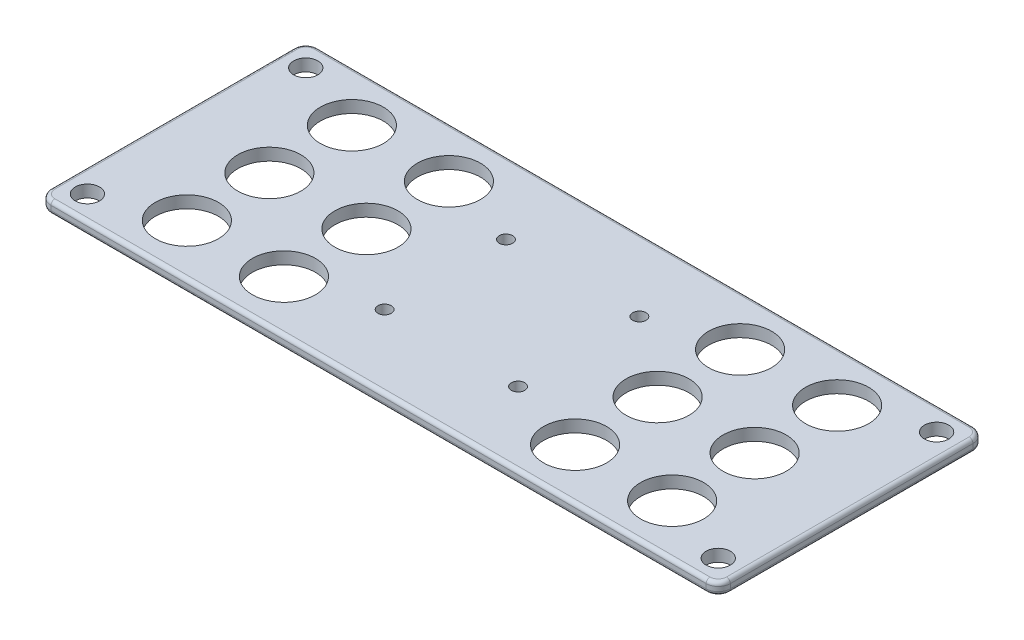
from build123d import *

# Parameters (mm, degrees)
SKETCH1_W           = 177.8
SKETCH1_H           = 69.85
BOSS_EXTRUDE1_DEPTH = 3.175
SKETCH2_R           = 3.175
CUT_EXTRUDE1_DEPTH  = 96.56697259
FILLET1_R           = 3.175
FILLET2_R           = 1.000000032
SKETCH3_R           = 1.74625
SKETCH3_R_2         = 8.255
CUT_EXTRUDE2_DEPTH  = 96.56697259


with BuildPart() as part:
    # Sketch1 → Boss-Extrude1 (new body)
    with BuildSketch(Plane(origin=(0, 0, 0), x_dir=(1, 0, 0), z_dir=(0, 1, 0))):
        Rectangle(SKETCH1_W, SKETCH1_H)
    extrude(amount=BOSS_EXTRUDE1_DEPTH)

    # Sketch2 → Cut-Extrude1 (cut, through all)
    with BuildSketch(Plane(origin=(0, 3.175, 0), x_dir=(1, 0, 0), z_dir=(0, 1, 0))):
        with Locations(Location((-82.55, 28.575, 0), (0, 0, 270))):
            Circle(SKETCH2_R)
        with Locations(Location((-82.55, -28.575, 0), (0, 0, 270))):
            Circle(SKETCH2_R)
        with Locations(Location((82.55, 28.575, 0), (0, 0, 270))):
            Circle(SKETCH2_R)
        with Locations(Location((82.55, -28.575, 0), (0, 0, 270))):
            Circle(SKETCH2_R)
    extrude(amount=-CUT_EXTRUDE1_DEPTH, mode=Mode.SUBTRACT)

    # Fillet1
    fillet1_edges = [part.edges().sort_by_distance(p)[0] for p in [
        (88.9, 1.5875, 34.925),
        (-88.9, 1.5875, 34.925),
        (-88.9, 1.5875, -34.925),
        (88.9, 1.5875, -34.925),
    ]]
    fillet(fillet1_edges, radius=FILLET1_R)

    # Fillet2
    fillet2_edges = [part.edges().sort_by_distance(p)[0] for p in [
        (0, 0, -34.925),
        (0, 3.175, -34.925),
        (88.9, 0, 0),
        (0, 0, 34.925),
        (-88.9, 0, 0),
        (-87.97006403, 0, 33.99506403),
        (-87.97006403, 0, -33.99506403),
        (87.97006403, 0, 33.99506403),
        (87.97006403, 0, -33.99506403),
        (88.9, 3.175, 0),
        (-88.9, 3.175, 0),
        (0, 3.175, 34.925),
        (-87.97006403, 3.175, 33.99506403),
        (-87.97006403, 3.175, -33.99506403),
        (87.97006403, 3.175, 33.99506403),
        (87.97006403, 3.175, -33.99506403),
    ]]
    fillet(fillet2_edges, radius=FILLET2_R)

    # Sketch3 → Cut-Extrude2 (cut, through all)
    with BuildSketch(Plane(origin=(0, 3.175, 0), x_dir=(1, 0, 0), z_dir=(0, 1, 0))):
        with Locations(Location((17.4625, 15.875, 0), (0, 0, 270))):
            Circle(SKETCH3_R)
        with Locations(Location((17.4625, -15.875, 0), (0, 0, 270))):
            Circle(SKETCH3_R)
        with Locations(Location((-17.4625, -15.875, 0), (0, 0, 270))):
            Circle(SKETCH3_R)
        with Locations(Location((-17.4625, 15.875, 0), (0, 0, 270))):
            Circle(SKETCH3_R)
        with Locations(Location((-63.5, 21.59, 0), (0, 0, 270))):
            Circle(SKETCH3_R_2)
        with Locations(Location((-38.1, 21.59, 0), (0, 0, 270))):
            Circle(SKETCH3_R_2)
        with Locations(Location((-38.1, 0, 0), (0, 0, 270))):
            Circle(SKETCH3_R_2)
        with Locations(Location((-63.5, 0, 0), (0, 0, 270))):
            Circle(SKETCH3_R_2)
        with Locations(Location((-38.1, -21.59, 0), (0, 0, 270))):
            Circle(SKETCH3_R_2)
        with Locations(Location((-63.5, -21.59, 0), (0, 0, 270))):
            Circle(SKETCH3_R_2)
        with Locations(Location((38.1, -21.59, 0), (0, 0, 270))):
            Circle(SKETCH3_R_2)
        with Locations(Location((63.5, -21.59, 0), (0, 0, 270))):
            Circle(SKETCH3_R_2)
        with Locations(Location((38.1, 0, 0), (0, 0, 270))):
            Circle(SKETCH3_R_2)
        with Locations(Location((63.5, 0, 0), (0, 0, 270))):
            Circle(SKETCH3_R_2)
        with Locations(Location((38.1, 21.59, 0), (0, 0, 270))):
            Circle(SKETCH3_R_2)
        with Locations(Location((63.5, 21.59, 0), (0, 0, 270))):
            Circle(SKETCH3_R_2)
    extrude(amount=-CUT_EXTRUDE2_DEPTH, mode=Mode.SUBTRACT)


solid = part.part
